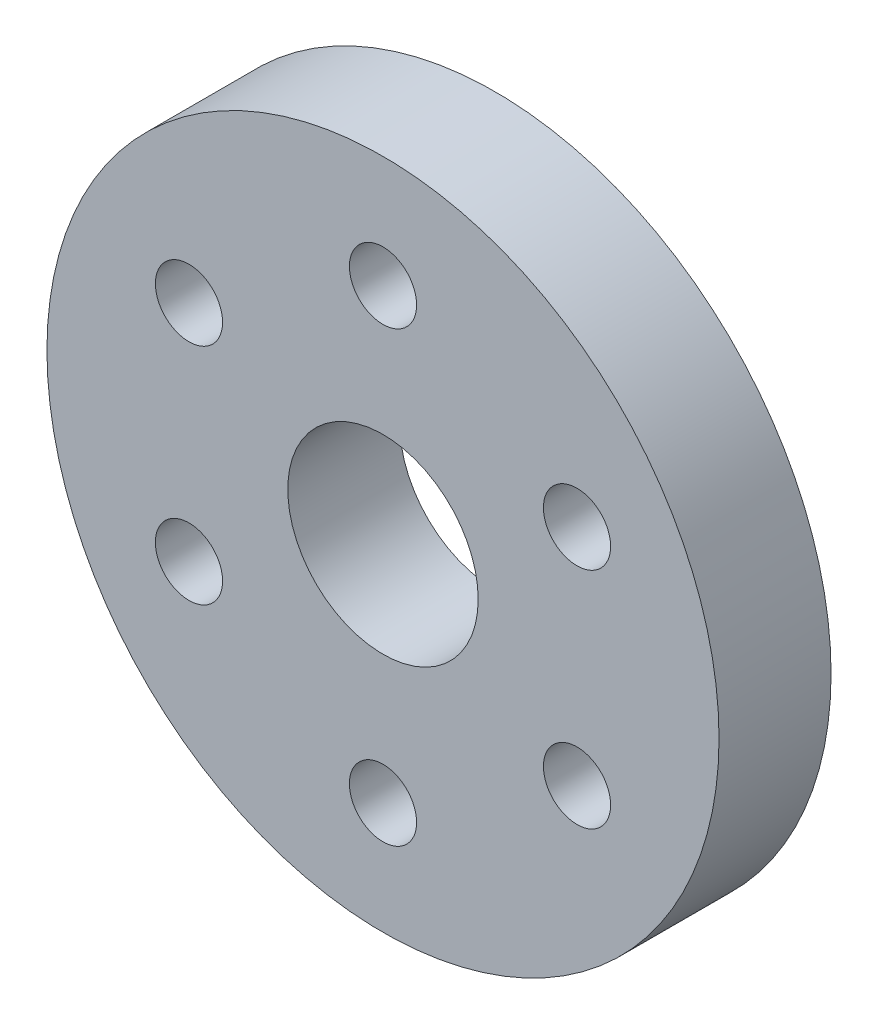
from build123d import *

# Parameters (mm, degrees)
ESQUISSE1_R        = 15
ESQUISSE1_R_2      = 4.25
ESQUISSE1_R_3      = 1.5
BOSS_EXTRU_1_DEPTH = 5


with BuildPart() as part:
    # Esquisse1 → Boss.-Extru.1 (new body)
    with BuildSketch(Plane.XY):
        Circle(ESQUISSE1_R)
        Circle(ESQUISSE1_R_2, mode=Mode.SUBTRACT)
        with Locations((0, 10)):
            Circle(ESQUISSE1_R_3, mode=Mode.SUBTRACT)
        with Locations((8.660254038, 5)):
            Circle(ESQUISSE1_R_3, mode=Mode.SUBTRACT)
        with Locations((8.660254038, -5)):
            Circle(ESQUISSE1_R_3, mode=Mode.SUBTRACT)
        with Locations((0, -10)):
            Circle(ESQUISSE1_R_3, mode=Mode.SUBTRACT)
        with Locations((-8.660254038, -5)):
            Circle(ESQUISSE1_R_3, mode=Mode.SUBTRACT)
        with Locations((-8.660254038, 5)):
            Circle(ESQUISSE1_R_3, mode=Mode.SUBTRACT)
    extrude(amount=BOSS_EXTRU_1_DEPTH)


solid = part.part
